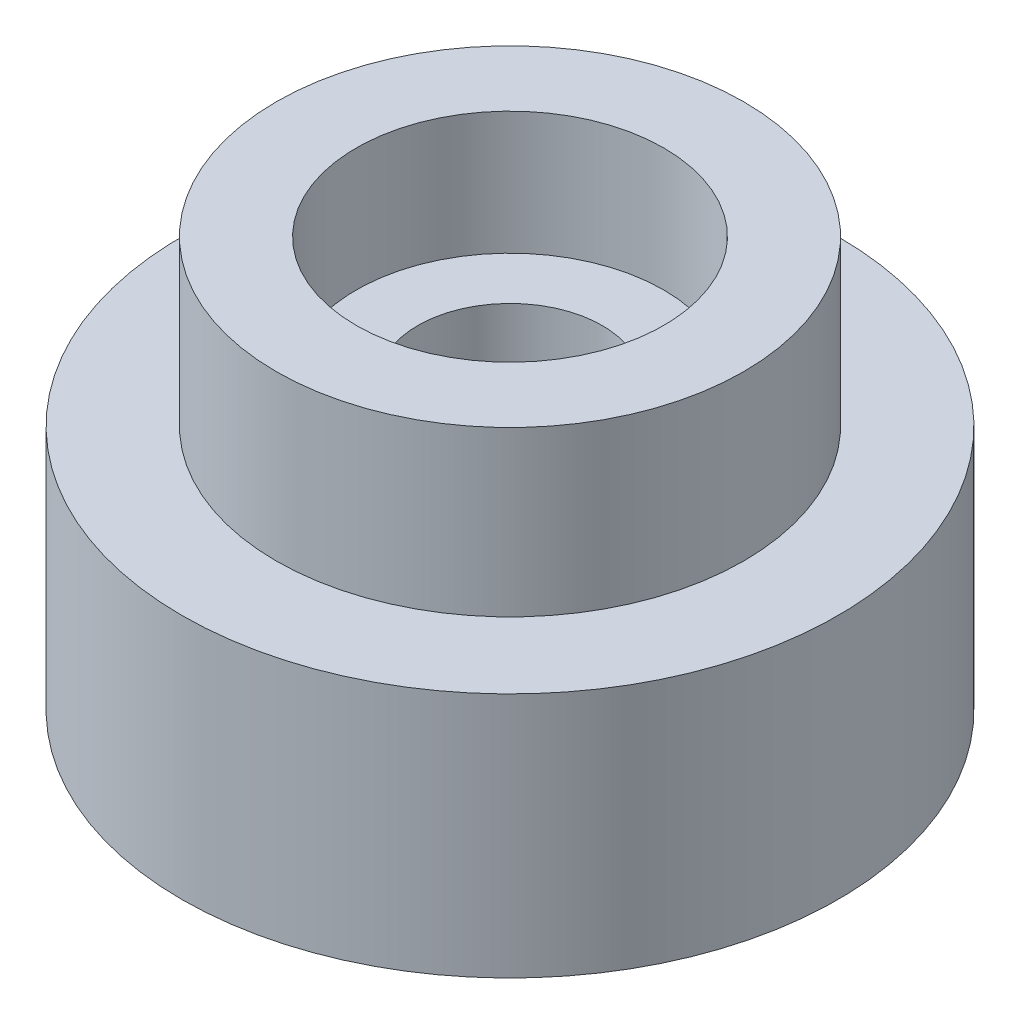
from build123d import *

# Parameters (mm, degrees)
CROQUIS1_R              = 4
SALIENTE_EXTRUIR1_DEPTH = 3
CROQUIS2_R              = 2.85
SALIENTE_EXTRUIR2_DEPTH = 2
CROQUIS3_R              = 1.125
CORTAR_EXTRUIR1_DEPTH   = 8.549834435
CROQUIS4_R              = 1.875
CORTAR_EXTRUIR2_DEPTH   = 1.5


with BuildPart() as part:
    # Croquis1 → Saliente-Extruir1 (new body)
    with BuildSketch(Plane(origin=(0, 0, 0), x_dir=(1, 0, 0), z_dir=(0, 1, 0))):
        with Locations(Location((0, 0, 0), (0, 0, 270))):
            Circle(CROQUIS1_R)
    extrude(amount=SALIENTE_EXTRUIR1_DEPTH)

    # Croquis2 → Saliente-Extruir2 (add)
    with BuildSketch(Plane(origin=(0, 3, 0), x_dir=(1, 0, 0), z_dir=(0, 1, 0))):
        with Locations(Location((0, 0, 0), (0, 0, 270))):
            Circle(CROQUIS2_R)
    extrude(amount=SALIENTE_EXTRUIR2_DEPTH)

    # Croquis3 → Cortar-Extruir1 (cut, through all)
    with BuildSketch(Plane(origin=(0, 5, 0), x_dir=(1, 0, 0), z_dir=(0, 1, 0))):
        with Locations(Location((0, 0, 0), (0, 0, 270))):
            Circle(CROQUIS3_R)
    extrude(amount=-CORTAR_EXTRUIR1_DEPTH, mode=Mode.SUBTRACT)

    # Croquis4 → Cortar-Extruir2 (cut)
    with BuildSketch(Plane(origin=(0, 5, 0), x_dir=(1, 0, 0), z_dir=(0, 1, 0))):
        with Locations(Location((0, 0, 0), (0, 0, 270))):
            Circle(CROQUIS4_R)
    extrude(amount=-CORTAR_EXTRUIR2_DEPTH, mode=Mode.SUBTRACT)


solid = part.part
